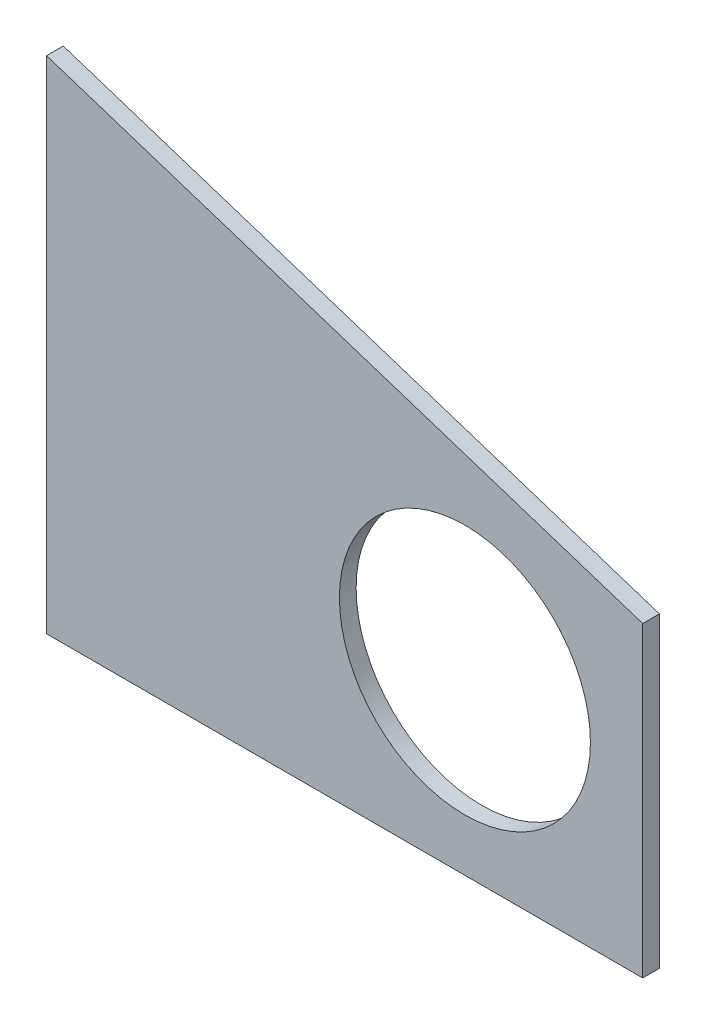
from build123d import *

# Parameters (mm, degrees)
SKETCH_1_R      = 60
EXTRUDE_1_DEPTH = 8


with BuildPart() as part:
    # 草图1 → 凸台-拉伸1 (new body)
    with BuildSketch(Plane.XY):
        Polygon((0, 0), (0, 239.358228307), (285, 146.75611488), (285, 0), align=None)
        with Locations((200, 85)):
            Circle(SKETCH_1_R, mode=Mode.SUBTRACT)
    extrude(amount=EXTRUDE_1_DEPTH)


solid = part.part
